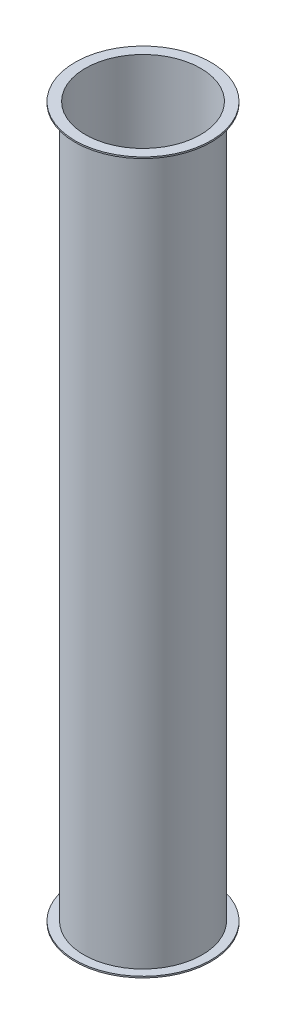
from build123d import *

# Parameters (mm, degrees)
SCHIZZO1_R                   = 40
SCHIZZO1_R_2                 = 39
ESTRUSIONE_SOTTILE1_DEPTH    = 481.5
ESTRUSIONE_ESTRUSIONE1_START = -1
SCHIZZO2_R                   = 46
SCHIZZO2_R_2                 = 40
ESTRUSIONE_ESTRUSIONE1_DEPTH = 1
SCHIZZO3_R                   = 46
SCHIZZO3_R_2                 = 40
ESTRUSIONE_ESTRUSIONE2_DEPTH = 1


with BuildPart() as part:
    # Schizzo1 → Estrusione-Sottile1 (new body)
    with BuildSketch(Plane(origin=(0, 0, 0), x_dir=(1, 0, 0), z_dir=(0, 1, 0))):
        Circle(SCHIZZO1_R)
        Circle(SCHIZZO1_R_2, mode=Mode.SUBTRACT)
    extrude(amount=ESTRUSIONE_SOTTILE1_DEPTH)

    # Schizzo2 → Estrusione-Estrusione1 (add)
    with BuildSketch(Plane(origin=(0, 481.5, 0), x_dir=(1, 0, 0), z_dir=(0, 1, 0)).offset(ESTRUSIONE_ESTRUSIONE1_START)):
        with Locations(Location((0, 0, 0), (0, 0, 270))):
            Circle(SCHIZZO2_R)
        with Locations(Location((0, 0, 0), (0, 0, 90))):
            Circle(SCHIZZO2_R_2, mode=Mode.SUBTRACT)
    extrude(amount=ESTRUSIONE_ESTRUSIONE1_DEPTH)

    # Schizzo3 → Estrusione-Estrusione2 (add)
    with BuildSketch(Plane.XZ):
        with Locations(Location((0, 0, 0), (0, 0, 90))):
            Circle(SCHIZZO3_R)
        with Locations(Location((0, 0, 0), (0, 0, 270))):
            Circle(SCHIZZO3_R_2, mode=Mode.SUBTRACT)
    extrude(amount=-ESTRUSIONE_ESTRUSIONE2_DEPTH)


solid = part.part
